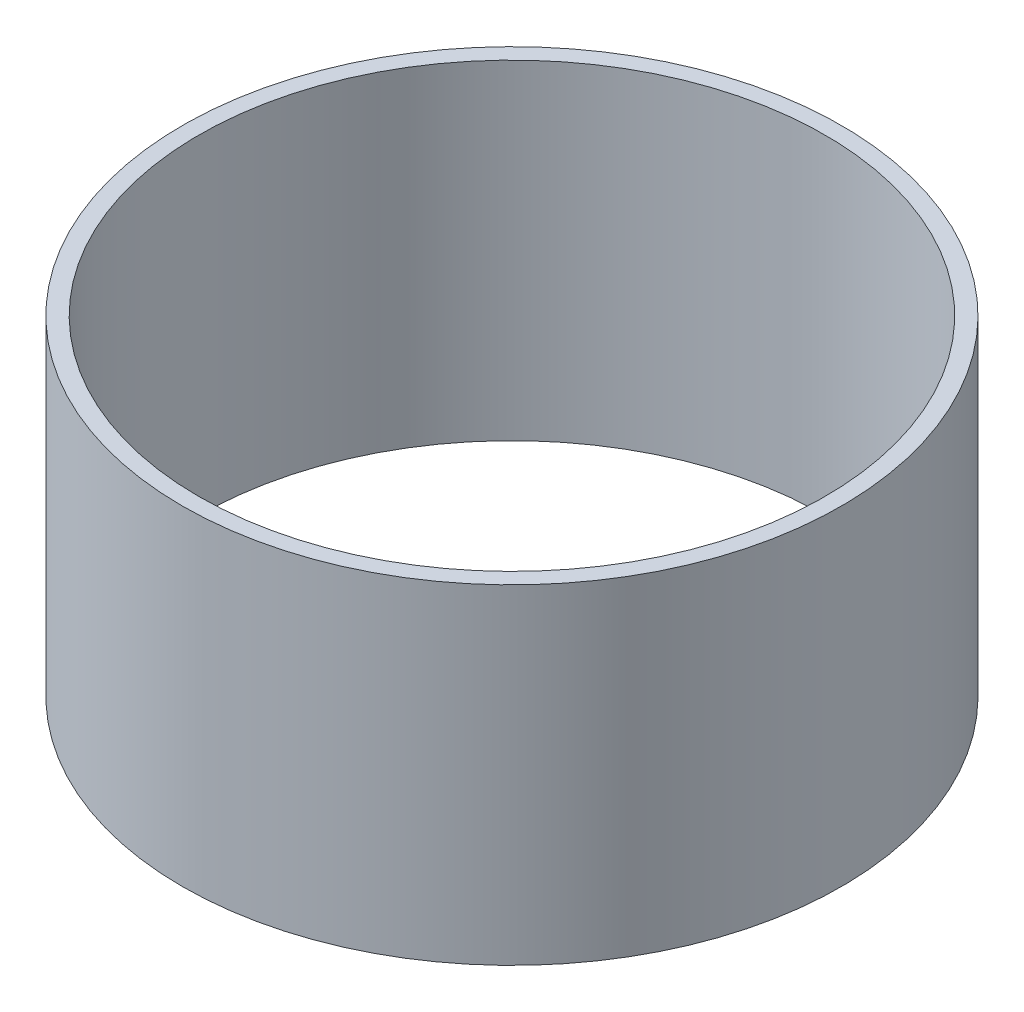
from build123d import *

# Parameters (mm, degrees)
SKETCH2_R           = 400
SKETCH2_R_2         = 380
BOSS_EXTRUDE1_DEPTH = 400


with BuildPart() as part:
    # Sketch2 → Boss-Extrude1 (new body)
    with BuildSketch(Plane(origin=(0, 0, 0), x_dir=(1, 0, 0), z_dir=(0, 1, 0))):
        with Locations(Location((0, 0, 0), (0, 0, 270))):
            Circle(SKETCH2_R)
        with Locations(Location((0, 0, 0), (0, 0, 270))):
            Circle(SKETCH2_R_2, mode=Mode.SUBTRACT)
    extrude(amount=BOSS_EXTRUDE1_DEPTH)


solid = part.part
